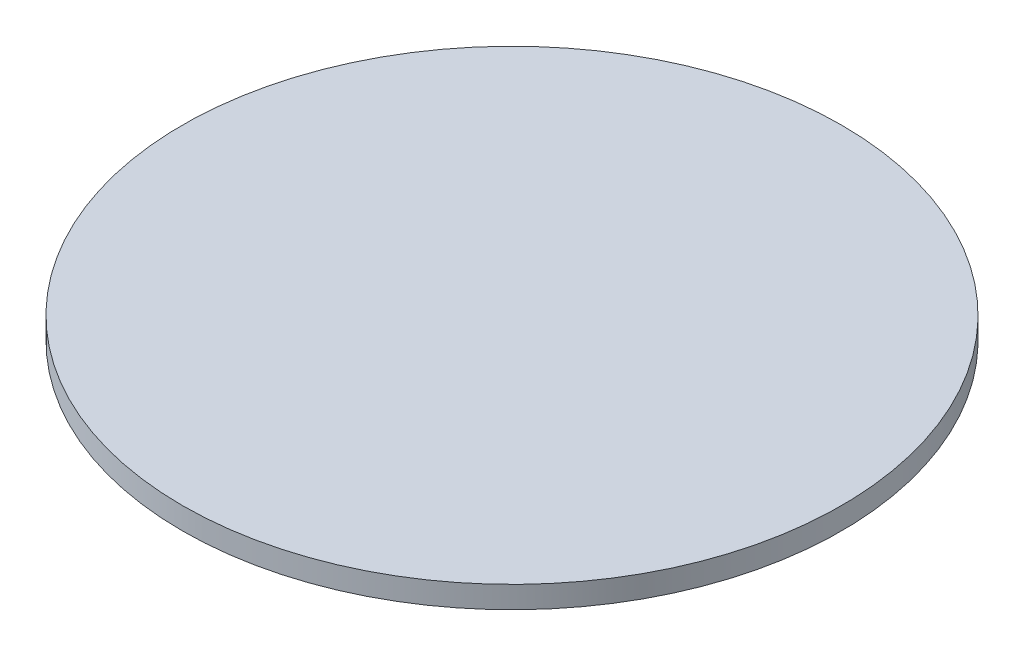
from build123d import *

# Parameters (mm, degrees)
SKETCH1_R           = 75
BOSS_EXTRUDE1_DEPTH = 5


with BuildPart() as part:
    # Sketch1 → Boss-Extrude1 (new body)
    with BuildSketch(Plane(origin=(0, 0, 0), x_dir=(1, 0, 0), z_dir=(0, 1, 0))):
        with Locations(Location((0, 0, 0), (0, 0, 270))):
            Circle(SKETCH1_R)
    extrude(amount=BOSS_EXTRUDE1_DEPTH)


solid = part.part
